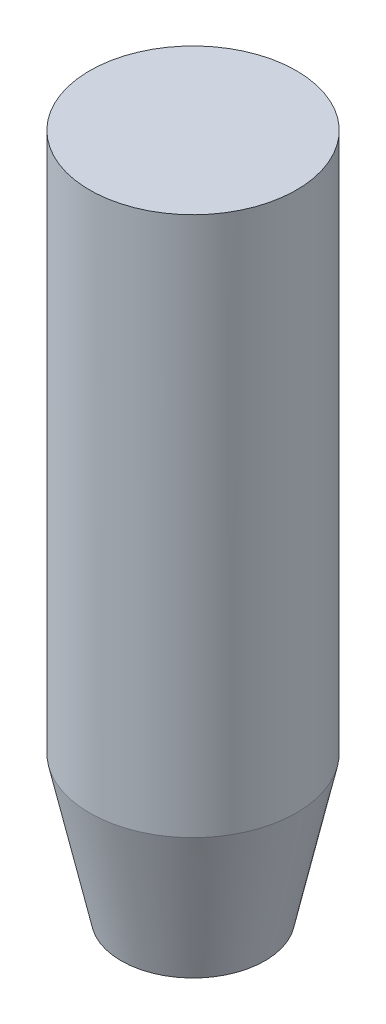
from build123d import *

# Parameters (mm, degrees)
SKETCH1_R           = 18.25625
BOSS_EXTRUDE1_DEPTH = 120.65
CHAMFER1_SIZE       = 5.55625
CHAMFER1_SIZE2      = 25.4


with BuildPart() as part:
    # Sketch1 → Boss-Extrude1 (new body)
    with BuildSketch(Plane(origin=(0, 0, 0), x_dir=(1, 0, 0), z_dir=(0, 1, 0))):
        with Locations(Location((0, 0, 0), (0, 0, 90))):
            Circle(SKETCH1_R)
    extrude(amount=BOSS_EXTRUDE1_DEPTH)

    # Chamfer1
    chamfer1_edges = [part.edges().sort_by_distance(p)[0] for p in [
        (0, 0, 18.25625),
    ]]
    chamfer1_side = [part.faces().sort_by_distance(p)[0] for p in [
        (0, 0, 0),
    ]]
    chamfer(chamfer1_edges, length=CHAMFER1_SIZE, length2=CHAMFER1_SIZE2, reference=chamfer1_side[0])


solid = part.part
